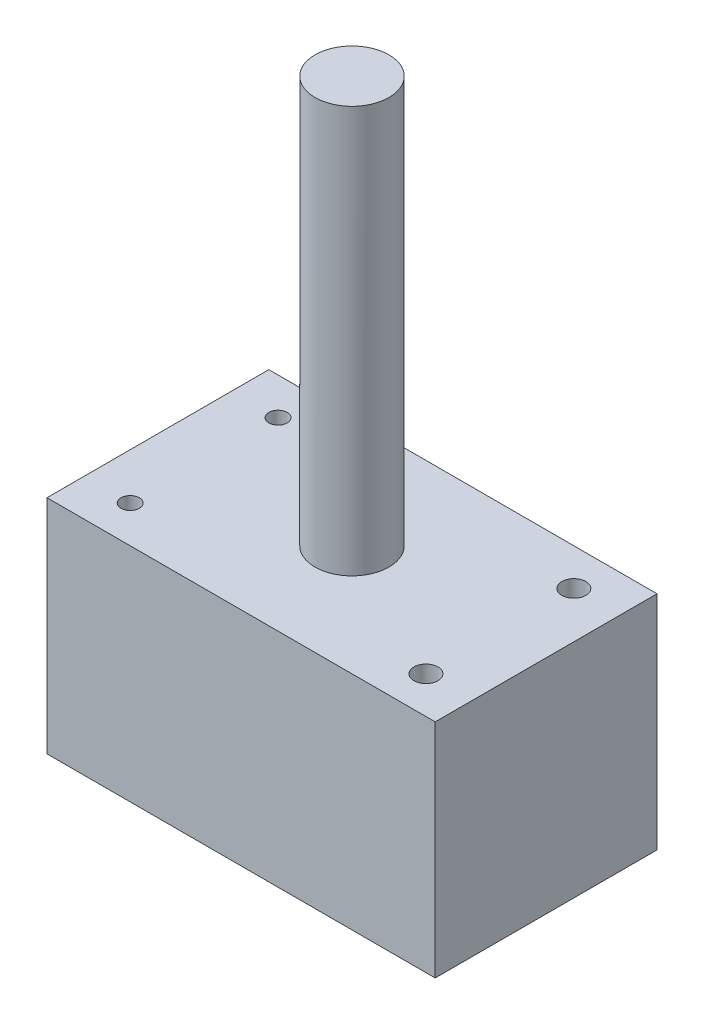
from build123d import *

# Parameters (mm, degrees)
F_01_HOUSING_PROFILE_W      = 105
F_01_HOUSING_PROFILE_H      = 60
F_01_HOUSING_PROFILE_R      = 2.480694692
F_01_HOUSING_PROFILE_R_2    = 3.25
F_01_HOUSING_BLOCK_DEPTH    = 60
F_03_OUTPUT_SHAFT_PROFILE_R = 10
F_03_OUTPUT_SHAFT_DEPTH     = 170


with BuildPart() as part:
    # 01_Housing_Profile → 01_Housing_Block (new body)
    with BuildSketch(Plane(origin=(0, 0, 0), x_dir=(1, 0, 0), z_dir=(0, 1, 0))):
        Rectangle(F_01_HOUSING_PROFILE_W, F_01_HOUSING_PROFILE_H)
        with Locations(Location((-40, -20, 0), (0, 0, 270))):
            Circle(F_01_HOUSING_PROFILE_R, mode=Mode.SUBTRACT)
        with Locations(Location((40, -20, 0), (0, 0, 270))):
            Circle(F_01_HOUSING_PROFILE_R_2, mode=Mode.SUBTRACT)
        with Locations(Location((-40, 20, 0), (0, 0, 270))):
            Circle(F_01_HOUSING_PROFILE_R, mode=Mode.SUBTRACT)
        with Locations(Location((40, 20, 0), (0, 0, 270))):
            Circle(F_01_HOUSING_PROFILE_R_2, mode=Mode.SUBTRACT)
    extrude(amount=F_01_HOUSING_BLOCK_DEPTH)

    # 03_Output_Shaft_Profile → 03_Output_Shaft (add)
    with BuildSketch(Plane(origin=(0, 0, 0), x_dir=(1, 0, 0), z_dir=(0, 1, 0))):
        with Locations(Location((0, 0, 0), (0, 0, 90))):
            Circle(F_03_OUTPUT_SHAFT_PROFILE_R)
    extrude(amount=F_03_OUTPUT_SHAFT_DEPTH)


solid = part.part
